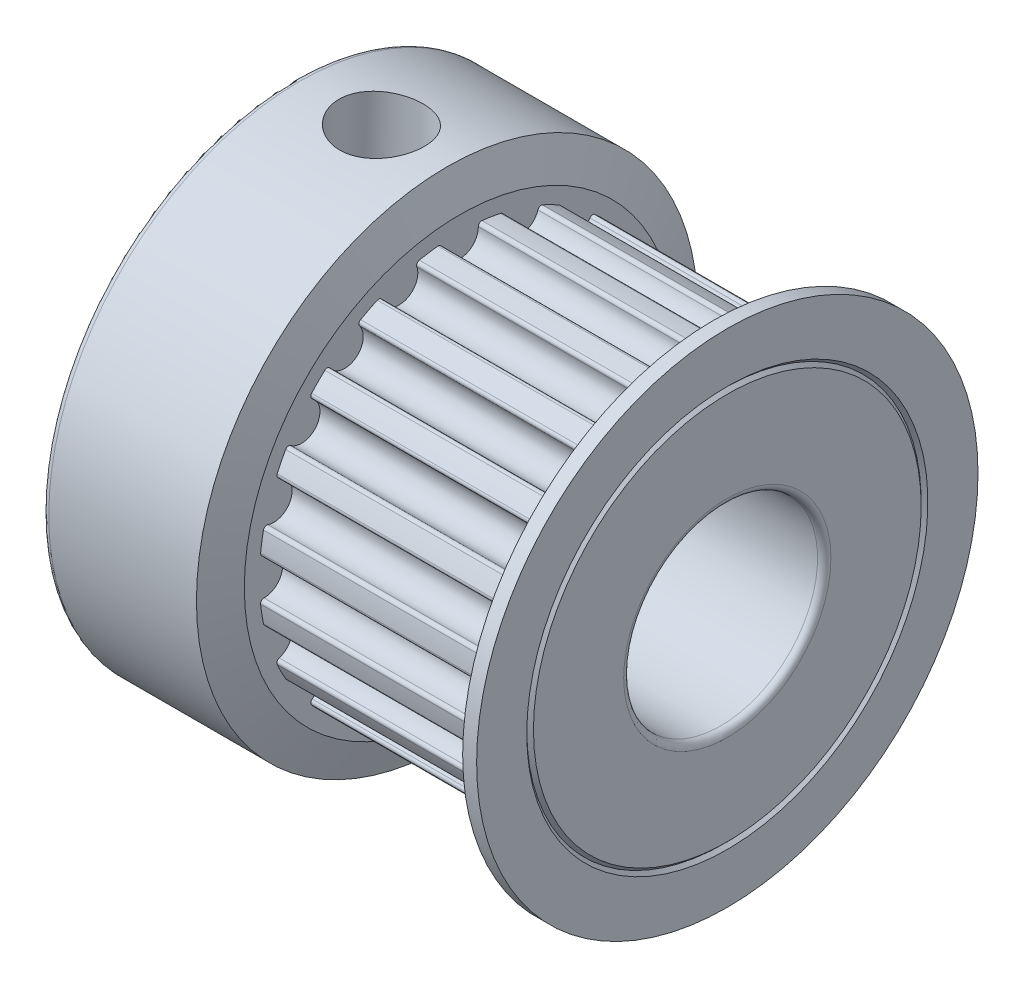
from build123d import *

# Parameters (mm, degrees)
SKETCH_3_R                = 0.55
CUT_EXTRUDE1_DEPTH        = 7.2
FILLET_2_R                = 0.1
CIRPATTERN1_COUNT         = 20
FILLET_2_OF_CIRPATTERN1_R = 0.1
M3_TAPPED_HOLE1_D         = 2.5
M3_TAPPED_HOLE1_DEPTH     = 7.5
M3_TAPPED_HOLE1_TIP       = 0.751075774
FILLET1_R                 = 0.2


with BuildPart() as part:
    # Sketch 1 → Body (revolve)
    with BuildSketch(Plane.XY, mode=Mode.PRIVATE) as body_sk:
        Polygon((1, 2.9), (1, 7.5), (5.617601306, 7.5), (6, 6.449368223), (6, 6), (13.2, 6), (13.2, 6.449368223), (13.582398694, 7.5), (14, 7.5), (14, 6), (13.9, 5.9), (14, 5.8), (14, 2.9), align=None)
    revolve(body_sk.sketch.rotate(Axis((1, 0, 0), (1, 0, 0)), 90), axis=Axis((1, 0, 0), (1, 0, 0)))

    # Sketch 3 → Cut-Extrude1 (cut)
    with BuildSketch(Plane(origin=(6, 0, 0), x_dir=(0, 0, -1), z_dir=(1, 0, 0))):
        with Locations((0, 5.855)):
            Circle(SKETCH_3_R)
    cut_extrude1 = extrude(amount=CUT_EXTRUDE1_DEPTH, mode=Mode.SUBTRACT)

    # Fillet 2
    fillet_2_edges = [part.edges().sort_by_distance(p)[0] for p in [
        (9.6, 5.975962852, -0.536533306),
        (9.6, 5.975962852, 0.536533306),
    ]]
    fillet(fillet_2_edges, radius=FILLET_2_R)

    # CirPattern1: Cut-Extrude1 ×20 about axis
    cirpattern1_axis = Axis((0, 0, 0), (1, 0, 0))
    for i in range(1, CIRPATTERN1_COUNT):
        add(cut_extrude1.rotate(cirpattern1_axis, i * 360 / CIRPATTERN1_COUNT), mode=Mode.SUBTRACT)

    # Fillet 2 of CirPattern1
    fillet_2_of_cirpattern1_edges = [part.edges().sort_by_distance(p)[0] for p in [
        (9.6, 5.849276321, 1.336400582),
        (9.6, 5.517680502, 2.356947576),
        (9.6, 5.15002187, 3.07851827),
        (9.6, 4.519289141, 3.946647395),
        (9.6, 3.946647395, 4.519289141),
        (9.6, 3.07851827, 5.15002187),
        (9.6, 2.356947576, 5.517680502),
        (9.6, 1.336400582, 5.849276321),
        (9.6, 0.536533306, 5.975962852),
        (9.6, -0.536533306, 5.975962852),
        (9.6, -1.336400582, 5.849276321),
        (9.6, -2.356947576, 5.517680502),
        (9.6, -3.07851827, 5.15002187),
        (9.6, -3.946647395, 4.519289141),
        (9.6, -4.519289141, 3.946647395),
        (9.6, -5.15002187, 3.07851827),
        (9.6, -5.517680502, 2.356947576),
        (9.6, -5.849276321, 1.336400582),
        (9.6, -5.975962852, 0.536533306),
        (9.6, -5.975962852, -0.536533306),
        (9.6, -5.849276321, -1.336400582),
        (9.6, -5.517680502, -2.356947576),
        (9.6, -5.15002187, -3.07851827),
        (9.6, -4.519289141, -3.946647395),
        (9.6, -3.946647395, -4.519289141),
        (9.6, -3.07851827, -5.15002187),
        (9.6, -2.356947576, -5.517680502),
        (9.6, -1.336400582, -5.849276321),
        (9.6, -0.536533306, -5.975962852),
        (9.6, 0.536533306, -5.975962852),
        (9.6, 1.336400582, -5.849276321),
        (9.6, 2.356947576, -5.517680502),
        (9.6, 3.07851827, -5.15002187),
        (9.6, 3.946647395, -4.519289141),
        (9.6, 4.519289141, -3.946647395),
        (9.6, 5.15002187, -3.07851827),
        (9.6, 5.517680502, -2.356947576),
        (9.6, 5.849276321, -1.336400582),
    ]]
    fillet(fillet_2_of_cirpattern1_edges, radius=FILLET_2_OF_CIRPATTERN1_R)

    # M3 Tapped Hole1
    with Locations(Plane(origin=(3.5, 7.498410891, -0.154382974), x_dir=(0, 0.02058439657, 0.999788118862), z_dir=(0, 0.999788118862, -0.02058439657))):
        with Locations((0, 0)):
            Hole(M3_TAPPED_HOLE1_D / 2, depth=M3_TAPPED_HOLE1_DEPTH)
            with Locations((0, 0, -(M3_TAPPED_HOLE1_DEPTH + M3_TAPPED_HOLE1_TIP / 2))):  # 118° drill point
                Cone(0, M3_TAPPED_HOLE1_D / 2, M3_TAPPED_HOLE1_TIP, mode=Mode.SUBTRACT)

    # Fillet1
    fillet1_edges = [part.edges().sort_by_distance(p)[0] for p in [
        (14, 0, -2.9),
        (1, 0, -2.9),
        (1, 0, -7.5),
        (3.5, 2.641948872, 1.195870459),
    ]]
    fillet(fillet1_edges, radius=FILLET1_R)


solid = part.part
